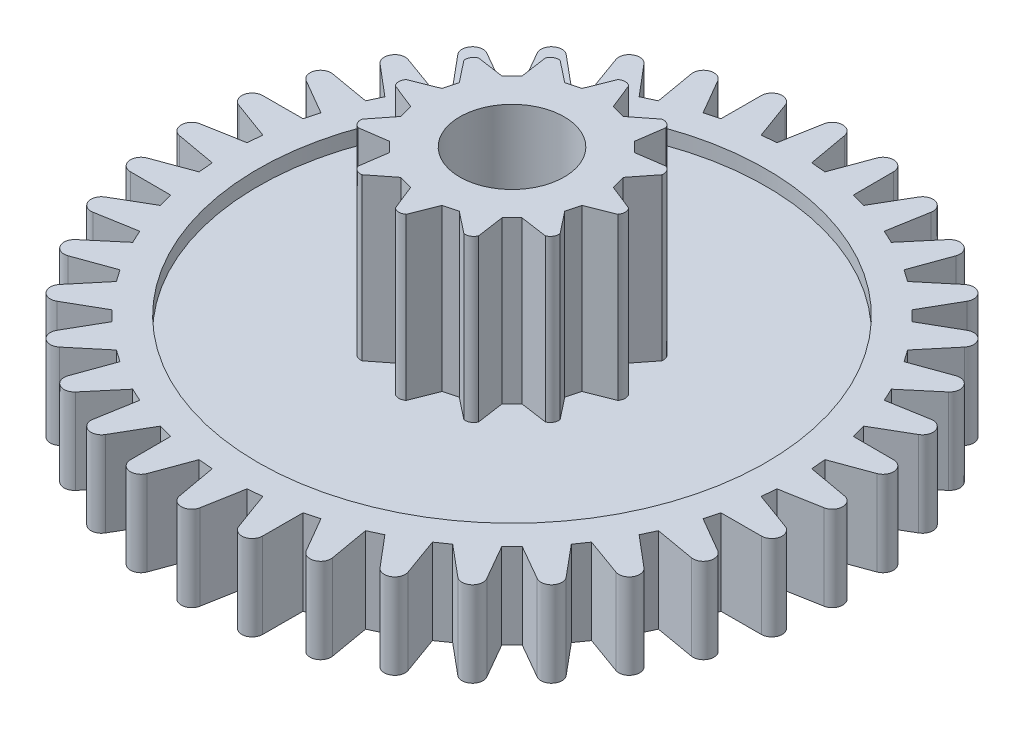
from build123d import *

# Parameters (mm, degrees)
RESSALTO_EXTRUS_O1_DEPTH     = 2.45
FURO_COM_FOLGA_DE_M121_D     = 14.6
FURO_COM_FOLGA_DE_M121_DEPTH = 0.43
RESSALTO_EXTRUS_O2_DEPTH     = 4.63
FURO_COM_FOLGA_DE_M122_D     = 14.6
FURO_COM_FOLGA_DE_M122_DEPTH = 0.43
INCLINA_O1_ANGLE             = 15.15090825
INCLINA_O2_ANGLE             = 15.15090825
INCLINA_O3_ANGLE             = 15.15090825
INCLINA_O4_ANGLE             = 15.15090825
INCLINA_O5_ANGLE             = 15.15090825
INCLINA_O6_ANGLE             = 15.15090825
INCLINA_O7_ANGLE             = 15.15090825
INCLINA_O8_ANGLE             = 15.15090825
ESBO_O7_W                    = 2.5
ESBO_O7_H                    = 0.43
FURO_DE_DI_METRO_3_0_3_1_D   = 3
CHANFRO1_SIZE                = 0.337017033
CHANFRO1_EDGE_2_SIZE         = 0.337017033
CHANFRO1_EDGE_3_SIZE         = 0.337017033
CHANFRO1_EDGE_4_SIZE         = 0.337017033
CHANFRO1_EDGE_5_SIZE         = 0.337017033
CHANFRO1_EDGE_6_SIZE         = 0.337017033
CHANFRO1_EDGE_7_SIZE         = 0.337017033
CHANFRO1_EDGE_8_SIZE         = 0.337017033
CHANFRO1_EDGE_9_SIZE         = 0.337017033
CHANFRO1_EDGE_10_SIZE        = 0.337017033
CHANFRO1_EDGE_11_SIZE        = 0.337017033
CHANFRO1_EDGE_12_SIZE        = 0.337017033


with BuildPart() as part:
    # Esboço1 → Ressalto-extrusão1 (new body)
    with BuildSketch(Plane.XZ.offset(1.225)):
        with BuildLine():
            Line((-0.5, -8.109600792), (-0.295304093, -9.252872421))
            ThreePointArc((-0.295304093, -9.252872421), (0, -9.5), (0.295304093, -9.252872421))
            Line((0.295304093, -9.252872421), (0.5, -8.109600792))
            Line((0.5, -8.109600792), (0.915813523, -8.073221822))
            Line((0.915813523, -8.073221822), (1.315926674, -9.163579516))
            ThreePointArc((1.315926674, -9.163579516), (1.649657688, -9.355673654), (1.897562194, -9.061021481))
            Line((1.897562194, -9.061021481), (1.900621276, -7.899573645))
            Line((1.900621276, -7.899573645), (2.367266453, -7.900802719))
            Line((2.367266453, -7.900802719), (2.887173675, -8.795855883))
            ThreePointArc((2.887173675, -8.795855883), (3.249191362, -8.927079897), (3.442163828, -8.593855987))
            Line((3.442163828, -8.593855987), (3.243493135, -7.44952195))
            Line((3.243493135, -7.44952195), (3.621787694, -7.2731203))
            Line((3.621787694, -7.2731203), (4.370695365, -8.160874621))
            ThreePointArc((4.370695365, -8.160874621), (4.75, -8.227241336), (4.882177057, -7.865570529))
            Line((4.882177057, -7.865570529), (4.487813098, -6.7731203))
            Line((4.487813098, -6.7731203), (4.829728687, -6.533708427))
            Line((4.829728687, -6.533708427), (5.721415687, -7.277929313))
            ThreePointArc((5.721415687, -7.277929313), (6.106482292, -7.27742221), (6.173847806, -6.898293689))
            Line((6.173847806, -6.898293689), (5.59577313, -5.890920818))
            Line((5.59577313, -5.890920818), (5.890920818, -5.59577313))
            Line((5.890920818, -5.59577313), (6.898293689, -6.173847806))
            ThreePointArc((6.898293689, -6.173847806), (7.27742221, -6.106482292), (7.277929313, -5.721415687))
            Line((7.277929313, -5.721415687), (6.533708427, -4.829728687))
            Line((6.533708427, -4.829728687), (6.7731203, -4.487813098))
            Line((6.7731203, -4.487813098), (7.865570529, -4.882177057))
            ThreePointArc((7.865570529, -4.882177057), (8.227241336, -4.75), (8.160874621, -4.370695365))
            Line((8.160874621, -4.370695365), (7.2731203, -3.621787694))
            Line((7.2731203, -3.621787694), (7.44952195, -3.243493135))
            Line((7.44952195, -3.243493135), (8.593855987, -3.442163828))
            ThreePointArc((8.593855987, -3.442163828), (8.927079897, -3.249191362), (8.795855883, -2.887173675))
            Line((8.795855883, -2.887173675), (7.900802719, -2.367266453))
            Line((7.900802719, -2.367266453), (7.899573645, -1.900621276))
            Line((7.899573645, -1.900621276), (9.061021481, -1.897562194))
            ThreePointArc((9.061021481, -1.897562194), (9.355673654, -1.649657688), (9.163579516, -1.315926674))
            Line((9.163579516, -1.315926674), (8.073221822, -0.915813523))
            Line((8.073221822, -0.915813523), (8.109600792, -0.5))
            Line((8.109600792, -0.5), (9.252872421, -0.295304093))
            ThreePointArc((9.252872421, -0.295304093), (9.5, 0), (9.252872421, 0.295304093))
            Line((9.252872421, 0.295304093), (8.109600792, 0.5))
            Line((8.109600792, 0.5), (8.073221822, 0.915813523))
            Line((8.073221822, 0.915813523), (9.163579516, 1.315926674))
            ThreePointArc((9.163579516, 1.315926674), (9.355673654, 1.649657688), (9.061021481, 1.897562194))
            Line((9.061021481, 1.897562194), (7.899573645, 1.900621276))
            Line((7.899573645, 1.900621276), (7.900802719, 2.367266453))
            Line((7.900802719, 2.367266453), (8.795855883, 2.887173675))
            ThreePointArc((8.795855883, 2.887173675), (8.927079897, 3.249191362), (8.593855987, 3.442163828))
            Line((8.593855987, 3.442163828), (7.44952195, 3.243493135))
            Line((7.44952195, 3.243493135), (7.2731203, 3.621787694))
            Line((7.2731203, 3.621787694), (8.160874621, 4.370695365))
            ThreePointArc((8.160874621, 4.370695365), (8.227241336, 4.75), (7.865570529, 4.882177057))
            Line((7.865570529, 4.882177057), (6.7731203, 4.487813098))
            Line((6.7731203, 4.487813098), (6.533708427, 4.829728687))
            Line((6.533708427, 4.829728687), (7.277929313, 5.721415687))
            ThreePointArc((7.277929313, 5.721415687), (7.27742221, 6.106482292), (6.898293689, 6.173847806))
            Line((6.898293689, 6.173847806), (5.890920818, 5.59577313))
            Line((5.890920818, 5.59577313), (5.59577313, 5.890920818))
            Line((5.59577313, 5.890920818), (6.173847806, 6.898293689))
            ThreePointArc((6.173847806, 6.898293689), (6.106482292, 7.27742221), (5.721415687, 7.277929313))
            Line((5.721415687, 7.277929313), (4.829728687, 6.533708427))
            Line((4.829728687, 6.533708427), (4.487813098, 6.7731203))
            Line((4.487813098, 6.7731203), (4.882177057, 7.865570529))
            ThreePointArc((4.882177057, 7.865570529), (4.75, 8.227241336), (4.370695365, 8.160874621))
            Line((4.370695365, 8.160874621), (3.621787694, 7.2731203))
            Line((3.621787694, 7.2731203), (3.243493135, 7.44952195))
            Line((3.243493135, 7.44952195), (3.442163828, 8.593855987))
            ThreePointArc((3.442163828, 8.593855987), (3.249191362, 8.927079897), (2.887173675, 8.795855883))
            Line((2.887173675, 8.795855883), (2.367266453, 7.900802719))
            Line((2.367266453, 7.900802719), (1.900621276, 7.899573645))
            Line((1.900621276, 7.899573645), (1.897562194, 9.061021481))
            ThreePointArc((1.897562194, 9.061021481), (1.649657688, 9.355673654), (1.315926674, 9.163579516))
            Line((1.315926674, 9.163579516), (0.915813523, 8.073221822))
            Line((0.915813523, 8.073221822), (0.5, 8.109600792))
            Line((0.5, 8.109600792), (0.295304093, 9.252872421))
            ThreePointArc((0.295304093, 9.252872421), (0, 9.5), (-0.295304093, 9.252872421))
            Line((-0.295304093, 9.252872421), (-0.5, 8.109600792))
            Line((-0.5, 8.109600792), (-0.915813523, 8.073221822))
            Line((-0.915813523, 8.073221822), (-1.315926674, 9.163579516))
            ThreePointArc((-1.315926674, 9.163579516), (-1.649657688, 9.355673654), (-1.897562194, 9.061021481))
            Line((-1.897562194, 9.061021481), (-1.900621276, 7.899573645))
            Line((-1.900621276, 7.899573645), (-2.367266453, 7.900802719))
            Line((-2.367266453, 7.900802719), (-2.887173675, 8.795855883))
            ThreePointArc((-2.887173675, 8.795855883), (-3.249191362, 8.927079897), (-3.442163828, 8.593855987))
            Line((-3.442163828, 8.593855987), (-3.243493135, 7.44952195))
            Line((-3.243493135, 7.44952195), (-3.621787694, 7.2731203))
            Line((-3.621787694, 7.2731203), (-4.370695365, 8.160874621))
            ThreePointArc((-4.370695365, 8.160874621), (-4.75, 8.227241336), (-4.882177057, 7.865570529))
            Line((-4.882177057, 7.865570529), (-4.487813098, 6.7731203))
            Line((-4.487813098, 6.7731203), (-4.829728687, 6.533708427))
            Line((-4.829728687, 6.533708427), (-5.721415687, 7.277929313))
            ThreePointArc((-5.721415687, 7.277929313), (-6.106482292, 7.27742221), (-6.173847806, 6.898293689))
            Line((-6.173847806, 6.898293689), (-5.59577313, 5.890920818))
            Line((-5.59577313, 5.890920818), (-5.890920818, 5.59577313))
            Line((-5.890920818, 5.59577313), (-6.898293689, 6.173847806))
            ThreePointArc((-6.898293689, 6.173847806), (-7.27742221, 6.106482292), (-7.277929313, 5.721415687))
            Line((-7.277929313, 5.721415687), (-6.533708427, 4.829728687))
            Line((-6.533708427, 4.829728687), (-6.7731203, 4.487813098))
            Line((-6.7731203, 4.487813098), (-7.865570529, 4.882177057))
            ThreePointArc((-7.865570529, 4.882177057), (-8.227241336, 4.75), (-8.160874621, 4.370695365))
            Line((-8.160874621, 4.370695365), (-7.2731203, 3.621787694))
            Line((-7.2731203, 3.621787694), (-7.44952195, 3.243493135))
            Line((-7.44952195, 3.243493135), (-8.593855987, 3.442163828))
            ThreePointArc((-8.593855987, 3.442163828), (-8.927079897, 3.249191362), (-8.795855883, 2.887173675))
            Line((-8.795855883, 2.887173675), (-7.900802719, 2.367266453))
            Line((-7.900802719, 2.367266453), (-7.899573645, 1.900621276))
            Line((-7.899573645, 1.900621276), (-9.061021481, 1.897562194))
            ThreePointArc((-9.061021481, 1.897562194), (-9.355673654, 1.649657688), (-9.163579516, 1.315926674))
            Line((-9.163579516, 1.315926674), (-8.073221822, 0.915813523))
            Line((-8.073221822, 0.915813523), (-8.109600792, 0.5))
            Line((-8.109600792, 0.5), (-9.252872421, 0.295304093))
            ThreePointArc((-9.252872421, 0.295304093), (-9.5, 0), (-9.252872421, -0.295304093))
            Line((-9.252872421, -0.295304093), (-8.109600792, -0.5))
            Line((-8.109600792, -0.5), (-8.073221822, -0.915813523))
            Line((-8.073221822, -0.915813523), (-9.163579516, -1.315926674))
            ThreePointArc((-9.163579516, -1.315926674), (-9.355673654, -1.649657688), (-9.061021481, -1.897562194))
            Line((-9.061021481, -1.897562194), (-7.899573645, -1.900621276))
            Line((-7.899573645, -1.900621276), (-7.900802719, -2.367266453))
            Line((-7.900802719, -2.367266453), (-8.795855883, -2.887173675))
            ThreePointArc((-8.795855883, -2.887173675), (-8.927079897, -3.249191362), (-8.593855987, -3.442163828))
            Line((-8.593855987, -3.442163828), (-7.44952195, -3.243493135))
            Line((-7.44952195, -3.243493135), (-7.2731203, -3.621787694))
            Line((-7.2731203, -3.621787694), (-8.160874621, -4.370695365))
            ThreePointArc((-8.160874621, -4.370695365), (-8.227241336, -4.75), (-7.865570529, -4.882177057))
            Line((-7.865570529, -4.882177057), (-6.7731203, -4.487813098))
            Line((-6.7731203, -4.487813098), (-6.533708427, -4.829728687))
            Line((-6.533708427, -4.829728687), (-7.277929313, -5.721415687))
            ThreePointArc((-7.277929313, -5.721415687), (-7.27742221, -6.106482292), (-6.898293689, -6.173847806))
            Line((-6.898293689, -6.173847806), (-5.890920818, -5.59577313))
            Line((-5.890920818, -5.59577313), (-5.59577313, -5.890920818))
            Line((-5.59577313, -5.890920818), (-6.173847806, -6.898293689))
            ThreePointArc((-6.173847806, -6.898293689), (-6.106482292, -7.27742221), (-5.721415687, -7.277929313))
            Line((-5.721415687, -7.277929313), (-4.829728687, -6.533708427))
            Line((-4.829728687, -6.533708427), (-4.487813098, -6.7731203))
            Line((-4.487813098, -6.7731203), (-4.882177057, -7.865570529))
            ThreePointArc((-4.882177057, -7.865570529), (-4.75, -8.227241336), (-4.370695365, -8.160874621))
            Line((-4.370695365, -8.160874621), (-3.621787694, -7.2731203))
            Line((-3.621787694, -7.2731203), (-3.243493135, -7.44952195))
            Line((-3.243493135, -7.44952195), (-3.442163828, -8.593855987))
            ThreePointArc((-3.442163828, -8.593855987), (-3.249191362, -8.927079897), (-2.887173675, -8.795855883))
            Line((-2.887173675, -8.795855883), (-2.367266453, -7.900802719))
            Line((-2.367266453, -7.900802719), (-1.900621276, -7.899573645))
            Line((-1.900621276, -7.899573645), (-1.897562194, -9.061021481))
            ThreePointArc((-1.897562194, -9.061021481), (-1.649657688, -9.355673654), (-1.315926674, -9.163579516))
            Line((-1.315926674, -9.163579516), (-0.915813523, -8.073221822))
            Line((-0.915813523, -8.073221822), (-0.5, -8.109600792))
        make_face()
    extrude(amount=-RESSALTO_EXTRUS_O1_DEPTH)

    # Furo com folga de M121
    with Locations(Plane(origin=(0, 1.225, 0), x_dir=(1, 0, 0), z_dir=(0, 1, 0))):
        with Locations((0, 0)):
            Hole(FURO_COM_FOLGA_DE_M121_D / 2, depth=FURO_COM_FOLGA_DE_M121_DEPTH)

    # Esboço4 → Ressalto-extrusão2 (add)
    with BuildSketch(Plane(origin=(0, 0.795, 0), x_dir=(-1, 0, 0), z_dir=(0, 1, 0))):
        with BuildLine():
            Line((-0.155651272, -3.19563405), (-0.575077692, -2.146219163))
            Line((-0.575077692, -2.146219163), (-1.463019069, -2.845325904))
            ThreePointArc((-1.463019069, -2.845325904), (-1.625, -2.814582562), (-1.732614981, -2.689674632))
            Line((-1.732614981, -2.689674632), (-1.571141472, -1.571141472))
            Line((-1.571141472, -1.571141472), (-2.689674632, -1.732614981))
            ThreePointArc((-2.689674632, -1.732614981), (-2.814582562, -1.625), (-2.845325904, -1.463019069))
            Line((-2.845325904, -1.463019069), (-2.146219163, -0.575077692))
            Line((-2.146219163, -0.575077692), (-3.19563405, -0.155651272))
            ThreePointArc((-3.19563405, -0.155651272), (-3.25, 0), (-3.19563405, 0.155651272))
            Line((-3.19563405, 0.155651272), (-2.146219163, 0.575077692))
            Line((-2.146219163, 0.575077692), (-2.845325904, 1.463019069))
            ThreePointArc((-2.845325904, 1.463019069), (-2.814582562, 1.625), (-2.689674632, 1.732614981))
            Line((-2.689674632, 1.732614981), (-1.571141472, 1.571141472))
            Line((-1.571141472, 1.571141472), (-1.732614981, 2.689674632))
            ThreePointArc((-1.732614981, 2.689674632), (-1.625, 2.814582562), (-1.463019069, 2.845325904))
            Line((-1.463019069, 2.845325904), (-0.575077692, 2.146219163))
            Line((-0.575077692, 2.146219163), (-0.155651272, 3.19563405))
            ThreePointArc((-0.155651272, 3.19563405), (0, 3.25), (0.155651272, 3.19563405))
            Line((0.155651272, 3.19563405), (0.575077692, 2.146219163))
            Line((0.575077692, 2.146219163), (1.463019069, 2.845325904))
            ThreePointArc((1.463019069, 2.845325904), (1.625, 2.814582562), (1.732614981, 2.689674632))
            Line((1.732614981, 2.689674632), (1.571141472, 1.571141472))
            Line((1.571141472, 1.571141472), (2.689674632, 1.732614981))
            ThreePointArc((2.689674632, 1.732614981), (2.814582562, 1.625), (2.845325904, 1.463019069))
            Line((2.845325904, 1.463019069), (2.146219163, 0.575077692))
            Line((2.146219163, 0.575077692), (3.19563405, 0.155651272))
            ThreePointArc((3.19563405, 0.155651272), (3.25, 0), (3.19563405, -0.155651272))
            Line((3.19563405, -0.155651272), (2.146219163, -0.575077692))
            Line((2.146219163, -0.575077692), (2.845325904, -1.463019069))
            ThreePointArc((2.845325904, -1.463019069), (2.814582562, -1.625), (2.689674632, -1.732614981))
            Line((2.689674632, -1.732614981), (1.571141472, -1.571141472))
            Line((1.571141472, -1.571141472), (1.732614981, -2.689674632))
            ThreePointArc((1.732614981, -2.689674632), (1.625, -2.814582562), (1.463019069, -2.845325904))
            Line((1.463019069, -2.845325904), (0.575077692, -2.146219163))
            Line((0.575077692, -2.146219163), (0.155651272, -3.19563405))
            ThreePointArc((0.155651272, -3.19563405), (0, -3.25), (-0.155651272, -3.19563405))
        make_face()
    extrude(amount=RESSALTO_EXTRUS_O2_DEPTH)

    # Furo com folga de M122
    with Locations(Plane(origin=(0, -1.225, 0), x_dir=(-1, 0, 0), z_dir=(0, -1, 0))):
        with Locations((0, 0)):
            Hole(FURO_COM_FOLGA_DE_M122_D / 2, depth=FURO_COM_FOLGA_DE_M122_DEPTH)

    # Inclinação1
    inclina_o1_faces = [part.faces().sort_by_distance(p)[0] for p in [
        (2.133943864, 0, -7.900188182),
    ]]
    draft(inclina_o1_faces, Plane(origin=(1.897562194, 1.225, -9.061021481), x_dir=(0.0026338427892532916, 0, 0.9999965314300653), z_dir=(0.9999965314300653, 0, -0.0026338427892532916)), INCLINA_O1_ANGLE)

    # Inclinação2
    inclina_o2_faces = [part.faces().sort_by_distance(p)[0] for p in [
        (7.900188182, 0, -2.133943864),
    ]]
    draft(inclina_o2_faces, Plane(origin=(7.899573645, 1.225, -1.900621276), x_dir=(-0.9999965314300653, 0, -0.0026338427892532916), z_dir=(0.0026338427892532916, 0, -0.9999965314300653)), INCLINA_O2_ANGLE)

    # Inclinação3
    inclina_o3_faces = [part.faces().sort_by_distance(p)[0] for p in [
        (7.900188182, 0, 2.133943864),
    ]]
    draft(inclina_o3_faces, Plane(origin=(9.061021481, 1.225, 1.897562194), x_dir=(0.9999965314300653, 0, -0.00263384278925146), z_dir=(0.00263384278925146, 0, 0.9999965314300653)), INCLINA_O3_ANGLE)

    # Inclinação4
    inclina_o4_faces = [part.faces().sort_by_distance(p)[0] for p in [
        (2.133943864, 0, 7.900188182),
    ]]
    draft(inclina_o4_faces, Plane(origin=(1.900621276, 1.225, 7.899573645), x_dir=(-0.0026338427892532916, 0, 0.9999965314300653), z_dir=(0.9999965314300653, 0, 0.0026338427892532916)), INCLINA_O4_ANGLE)

    # Inclinação5
    inclina_o5_faces = [part.faces().sort_by_distance(p)[0] for p in [
        (-2.133943864, 0, 7.900188182),
    ]]
    draft(inclina_o5_faces, Plane(origin=(-1.897562194, 1.225, 9.061021481), x_dir=(-0.0026338427892532916, 0, -0.9999965314300653), z_dir=(-0.9999965314300653, 0, 0.0026338427892532916)), INCLINA_O5_ANGLE)

    # Inclinação6
    inclina_o6_faces = [part.faces().sort_by_distance(p)[0] for p in [
        (-7.900188182, 0, 2.133943864),
    ]]
    draft(inclina_o6_faces, Plane(origin=(-7.899573645, 1.225, 1.900621276), x_dir=(0.9999965314300653, 0, 0.0026338427892532916), z_dir=(-0.0026338427892532916, 0, 0.9999965314300653)), INCLINA_O6_ANGLE)

    # Inclinação7
    inclina_o7_faces = [part.faces().sort_by_distance(p)[0] for p in [
        (-7.900188182, 0, -2.133943864),
    ]]
    draft(inclina_o7_faces, Plane(origin=(-9.061021481, 1.225, -1.897562194), x_dir=(-0.9999965314300653, 0, 0.0026338427892532916), z_dir=(-0.0026338427892532916, 0, -0.9999965314300653)), INCLINA_O7_ANGLE)

    # Inclinação8
    inclina_o8_faces = [part.faces().sort_by_distance(p)[0] for p in [
        (-2.133943864, 0, -7.900188182),
    ]]
    draft(inclina_o8_faces, Plane(origin=(-1.900621276, 1.225, -7.899573645), x_dir=(0.0026338427892532916, 0, -0.9999965314300653), z_dir=(-0.9999965314300653, 0, -0.0026338427892532916)), INCLINA_O8_ANGLE)

    # Esboço7 → Revolução1 (revolve)
    with BuildSketch(Plane(origin=(0, 0, 0), x_dir=(-1, 0, 0), z_dir=(0, 0, -1)), mode=Mode.PRIVATE) as revolu_o1_sk:
        with Locations((-1.25, -1.01)):
            Rectangle(ESBO_O7_W, ESBO_O7_H)
    revolve(revolu_o1_sk.sketch.rotate(Axis((0, -1.225, 0), (0, 1, 0)), 270), axis=Axis((0, -1.225, 0), (0, 1, 0)))

    # Furo de diâmetro Ø3.0 (3)1 (through all)
    with Locations(Plane(origin=(0, 5.425, 0), x_dir=(1, 0, 0), z_dir=(0, 1, 0))):
        with Locations((0, 0)):
            Hole(FURO_DE_DI_METRO_3_0_3_1_D / 2)

    # Chanfro1
    chanfro1_edges = [part.edges().sort_by_distance(p)[0] for p in [
        (-0.575077692, 3.11, -2.146219163),
    ]]
    chamfer(chanfro1_edges, length=CHANFRO1_SIZE)

    # Chanfro1 edge 2
    chanfro1_edge_2_edges = [part.edges().sort_by_distance(p)[0] for p in [
        (-1.571141472, 3.11, -1.571141472),
    ]]
    chamfer(chanfro1_edge_2_edges, length=CHANFRO1_EDGE_2_SIZE)

    # Chanfro1 edge 3
    chanfro1_edge_3_edges = [part.edges().sort_by_distance(p)[0] for p in [
        (-2.146219163, 3.11, -0.575077692),
    ]]
    chamfer(chanfro1_edge_3_edges, length=CHANFRO1_EDGE_3_SIZE)

    # Chanfro1 edge 4
    chanfro1_edge_4_edges = [part.edges().sort_by_distance(p)[0] for p in [
        (-2.146219163, 3.11, 0.575077692),
    ]]
    chamfer(chanfro1_edge_4_edges, length=CHANFRO1_EDGE_4_SIZE)

    # Chanfro1 edge 5
    chanfro1_edge_5_edges = [part.edges().sort_by_distance(p)[0] for p in [
        (-1.571141472, 3.11, 1.571141472),
    ]]
    chamfer(chanfro1_edge_5_edges, length=CHANFRO1_EDGE_5_SIZE)

    # Chanfro1 edge 6
    chanfro1_edge_6_edges = [part.edges().sort_by_distance(p)[0] for p in [
        (-0.575077692, 3.11, 2.146219163),
    ]]
    chamfer(chanfro1_edge_6_edges, length=CHANFRO1_EDGE_6_SIZE)

    # Chanfro1 edge 7
    chanfro1_edge_7_edges = [part.edges().sort_by_distance(p)[0] for p in [
        (0.575077692, 3.11, 2.146219163),
    ]]
    chamfer(chanfro1_edge_7_edges, length=CHANFRO1_EDGE_7_SIZE)

    # Chanfro1 edge 8
    chanfro1_edge_8_edges = [part.edges().sort_by_distance(p)[0] for p in [
        (1.571141472, 3.11, 1.571141472),
    ]]
    chamfer(chanfro1_edge_8_edges, length=CHANFRO1_EDGE_8_SIZE)

    # Chanfro1 edge 9
    chanfro1_edge_9_edges = [part.edges().sort_by_distance(p)[0] for p in [
        (2.146219163, 3.11, 0.575077692),
    ]]
    chamfer(chanfro1_edge_9_edges, length=CHANFRO1_EDGE_9_SIZE)

    # Chanfro1 edge 10
    chanfro1_edge_10_edges = [part.edges().sort_by_distance(p)[0] for p in [
        (2.146219163, 3.11, -0.575077692),
    ]]
    chamfer(chanfro1_edge_10_edges, length=CHANFRO1_EDGE_10_SIZE)

    # Chanfro1 edge 11
    chanfro1_edge_11_edges = [part.edges().sort_by_distance(p)[0] for p in [
        (1.571141472, 3.11, -1.571141472),
    ]]
    chamfer(chanfro1_edge_11_edges, length=CHANFRO1_EDGE_11_SIZE)

    # Chanfro1 edge 12
    chanfro1_edge_12_edges = [part.edges().sort_by_distance(p)[0] for p in [
        (0.575077692, 3.11, -2.146219163),
    ]]
    chamfer(chanfro1_edge_12_edges, length=CHANFRO1_EDGE_12_SIZE)


solid = part.part
